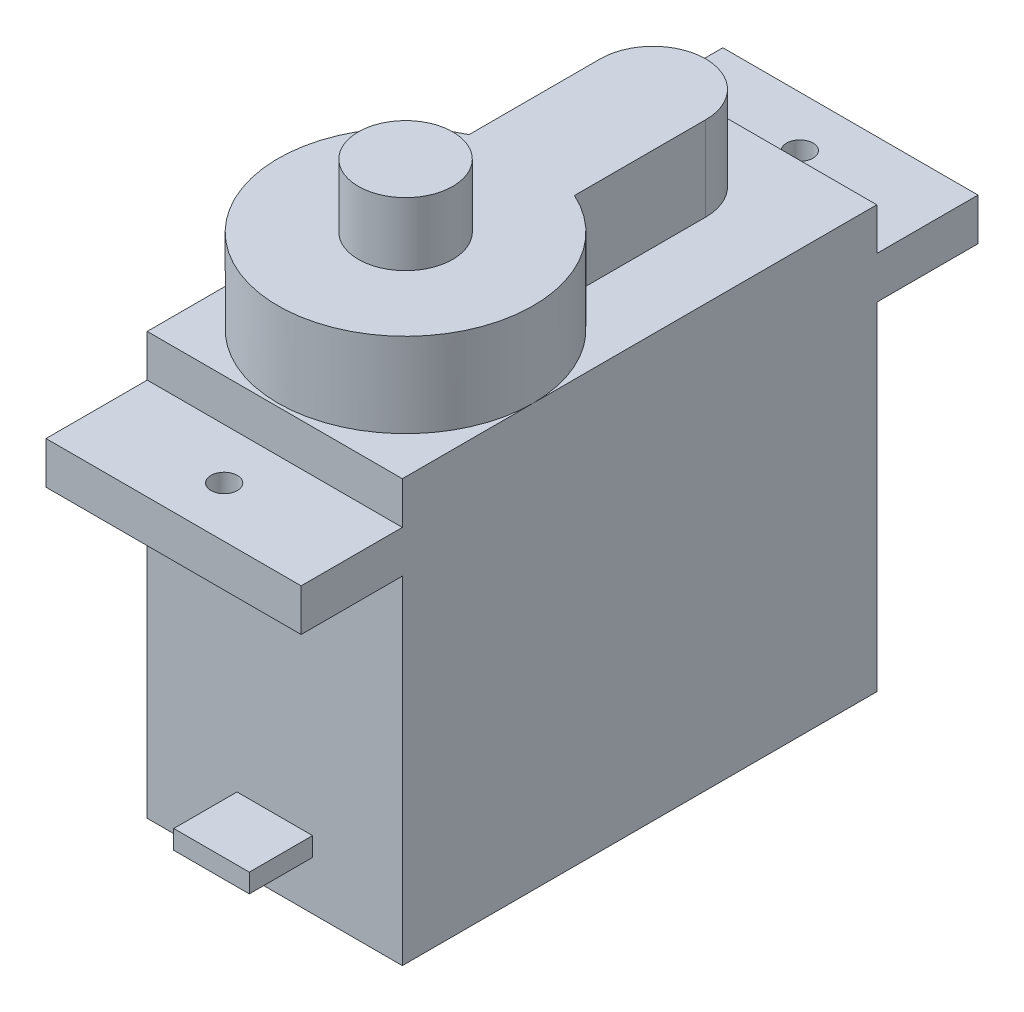
from build123d import *

# Parameters (mm, degrees)
SKETCH_1_W          = 12.1
SKETCH_1_H          = 22.5
EXTRUDE_1_DEPTH     = 20
SKETCH_2_W          = 12.1
SKETCH_2_H          = 2
EXTRUDE_2_DEPTH     = 4.8
SKETCH_3_W          = 12.1
SKETCH_3_H          = 2
EXTRUDE_3_DEPTH     = 4.8
SKETCH_4_R          = 0.625
CUT_EXTRUDE_1_DEPTH = 35.843819526
EXTRUDE_4_DEPTH     = 4
SKETCH_6_R          = 2.239241923
EXTRUDE_5_DEPTH     = 3
SKETCH_7_W          = 3.584102009
SKETCH_7_H          = 0.896025503
EXTRUDE_6_DEPTH     = 3


with BuildPart() as part:
    # 草图1 → 凸台-拉伸1 (new body)
    with BuildSketch(Plane(origin=(0, 0, 0), x_dir=(1, 0, 0), z_dir=(0, 1, 0))):
        with Locations((5.726041667, -11.361979167)):
            Rectangle(SKETCH_1_W, SKETCH_1_H)
    extrude(amount=EXTRUDE_1_DEPTH)

    # 草图2 → 凸台-拉伸2 (add)
    with BuildSketch(Plane.XY.offset(22.611979167)):
        with Locations((5.726041667, 17)):
            Rectangle(SKETCH_2_W, SKETCH_2_H)
    extrude(amount=EXTRUDE_2_DEPTH)

    # 草图3 → 凸台-拉伸3 (add)
    with BuildSketch(Plane(origin=(0, 0, 0.111979167), x_dir=(-1, 0, 0), z_dir=(0, 0, -1))):
        with Locations((-5.726041667, 17)):
            Rectangle(SKETCH_3_W, SKETCH_3_H)
    extrude(amount=EXTRUDE_3_DEPTH)

    # 草图4 → 切除-拉伸1 (cut, through all)
    with BuildSketch(Plane(origin=(0, 18, 0), x_dir=(1, 0, 0), z_dir=(0, 1, 0))):
        with Locations(Location((5.726041667, 2.288020833, 0), (0, 0, 270))):
            Circle(SKETCH_4_R)
        with Locations(Location((5.726041667, -25.011979167, 0), (0, 0, 270))):
            Circle(SKETCH_4_R)
    extrude(amount=-CUT_EXTRUDE_1_DEPTH, mode=Mode.SUBTRACT)

    # 草图5 → 凸台-拉伸4 (add)
    with BuildSketch(Plane(origin=(0, 20, 0), x_dir=(1, 0, 0), z_dir=(0, 1, 0))):
        with BuildLine():
            Line((8.226041667, -4.676017513), (8.226041667, -10.900780437))
            ThreePointArc((8.226041667, -10.900780437), (5.726041667, -22.460090739), (3.226041667, -10.900780437))
            Line((3.226041667, -10.900780437), (3.226041667, -4.676017412))
            ThreePointArc((3.226041667, -4.676017412), (5.726041717, -2.176017463), (8.226041667, -4.676017513))
        make_face()
    extrude(amount=EXTRUDE_4_DEPTH)

    # 草图6 → 凸台-拉伸5 (add)
    with BuildSketch(Plane(origin=(0, 24, 0), x_dir=(1, 0, 0), z_dir=(0, 1, 0))):
        with Locations(Location((5.726041667, -16.410090739, 0), (0, 0, 270))):
            Circle(SKETCH_6_R)
    extrude(amount=EXTRUDE_5_DEPTH)

    # 草图7 → 凸台-拉伸6 (add)
    with BuildSketch(Plane.XY.offset(22.611979167)):
        with Locations((5.726041667, 2.764925233)):
            Rectangle(SKETCH_7_W, SKETCH_7_H)
    extrude(amount=EXTRUDE_6_DEPTH)


solid = part.part
